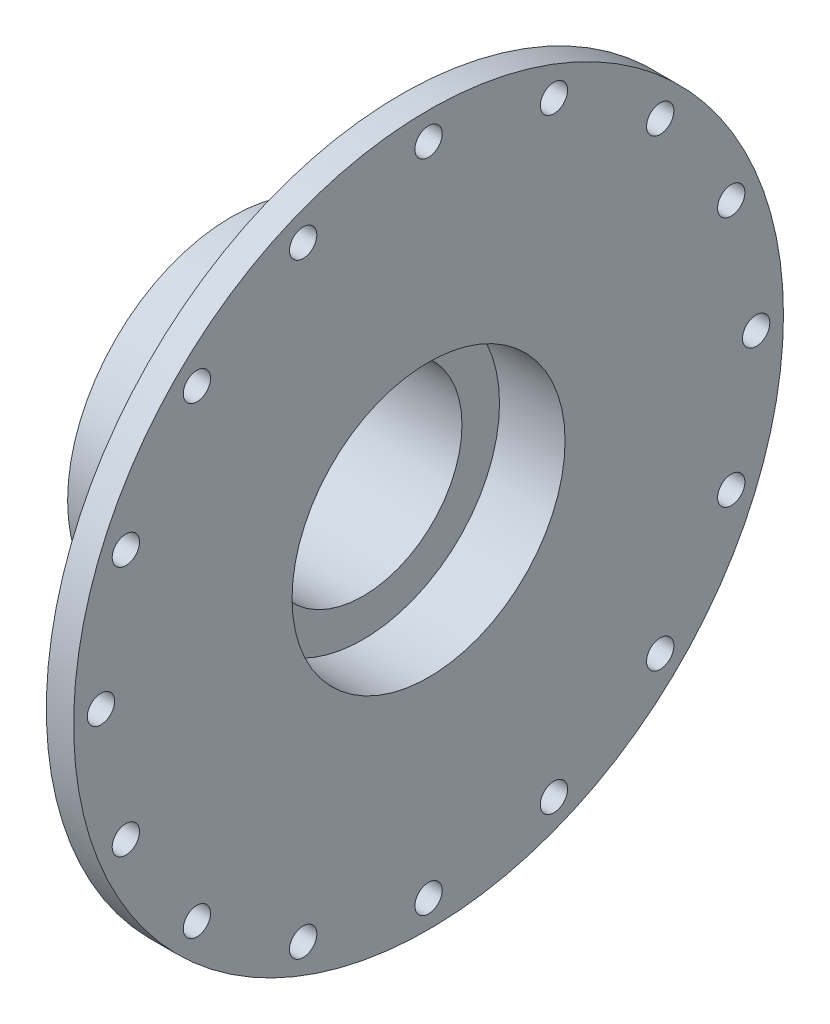
from build123d import *

# Parameters (mm, degrees)
SKETCH1_R           = 130
SKETCH1_R_2         = 5
SKETCH1_R_3         = 36.2419
BOSS_EXTRUDE1_DEPTH = 10
BOSS_EXTRUDE2_START = -50
SKETCH2_R           = 60
SKETCH2_R_2         = 36.2419
BOSS_EXTRUDE2_DEPTH = 50
FILLET1_R           = 10
SKETCH3_R           = 50
CUT_EXTRUDE1_DEPTH  = 24
BOSS_EXTRUDE3_START = 22.2
SKETCH4_R           = 60
SKETCH4_R_2         = 36.2419
BOSS_EXTRUDE3_DEPTH = 22.2


with BuildPart() as part:
    # Sketch1 → Boss-Extrude1 (new body)
    with BuildSketch(Plane(origin=(0, 0, 0), x_dir=(0, 0, -1), z_dir=(1, 0, 0))):
        Circle(SKETCH1_R)
        with Locations((0, 120)):
            Circle(SKETCH1_R_2, mode=Mode.SUBTRACT)
        with Locations((45.922011884, 110.865543901)):
            Circle(SKETCH1_R_2, mode=Mode.SUBTRACT)
        with Locations((84.852813742, 84.852813742)):
            Circle(SKETCH1_R_2, mode=Mode.SUBTRACT)
        with Locations((110.865543901, 45.922011884)):
            Circle(SKETCH1_R_2, mode=Mode.SUBTRACT)
        with Locations((120, 0)):
            Circle(SKETCH1_R_2, mode=Mode.SUBTRACT)
        with Locations((110.865543901, -45.922011884)):
            Circle(SKETCH1_R_2, mode=Mode.SUBTRACT)
        with Locations((84.852813742, -84.852813742)):
            Circle(SKETCH1_R_2, mode=Mode.SUBTRACT)
        with Locations((45.922011884, -110.865543901)):
            Circle(SKETCH1_R_2, mode=Mode.SUBTRACT)
        with Locations((0, -120)):
            Circle(SKETCH1_R_2, mode=Mode.SUBTRACT)
        with Locations((-45.922011884, -110.865543901)):
            Circle(SKETCH1_R_2, mode=Mode.SUBTRACT)
        with Locations((-84.852813742, -84.852813742)):
            Circle(SKETCH1_R_2, mode=Mode.SUBTRACT)
        with Locations((-110.865543901, -45.922011884)):
            Circle(SKETCH1_R_2, mode=Mode.SUBTRACT)
        with Locations((-120, 0)):
            Circle(SKETCH1_R_2, mode=Mode.SUBTRACT)
        with Locations((-110.865543901, 45.922011884)):
            Circle(SKETCH1_R_2, mode=Mode.SUBTRACT)
        with Locations((-84.852813742, 84.852813742)):
            Circle(SKETCH1_R_2, mode=Mode.SUBTRACT)
        with Locations((-45.922011884, 110.865543901)):
            Circle(SKETCH1_R_2, mode=Mode.SUBTRACT)
        Circle(SKETCH1_R_3, mode=Mode.SUBTRACT)
    extrude(amount=BOSS_EXTRUDE1_DEPTH)

    # Sketch2 → Boss-Extrude2 (add)
    with BuildSketch(Plane(origin=(10, 0, 0), x_dir=(0, 0, -1), z_dir=(1, 0, 0)).offset(BOSS_EXTRUDE2_START)):
        Circle(SKETCH2_R)
        Circle(SKETCH2_R_2, mode=Mode.SUBTRACT)
    extrude(amount=BOSS_EXTRUDE2_DEPTH)

    # Fillet1
    fillet1_edges = [part.edges().sort_by_distance(p)[0] for p in [
        (0, 0, 60),
    ]]
    fillet(fillet1_edges, radius=FILLET1_R)

    # Sketch3 → Cut-Extrude1 (cut)
    with BuildSketch(Plane(origin=(10, 0, 0), x_dir=(0, 0, -1), z_dir=(1, 0, 0))):
        Circle(SKETCH3_R)
    extrude(amount=-CUT_EXTRUDE1_DEPTH, mode=Mode.SUBTRACT)

    # Sketch4 → Boss-Extrude3 (add)
    with BuildSketch(Plane.ZY.offset(40).offset(BOSS_EXTRUDE3_START)):
        with Locations(Location((0, 0, 0), (0, 0, 180))):
            Circle(SKETCH4_R)
        Circle(SKETCH4_R_2, mode=Mode.SUBTRACT)
    extrude(amount=-BOSS_EXTRUDE3_DEPTH)


solid = part.part
